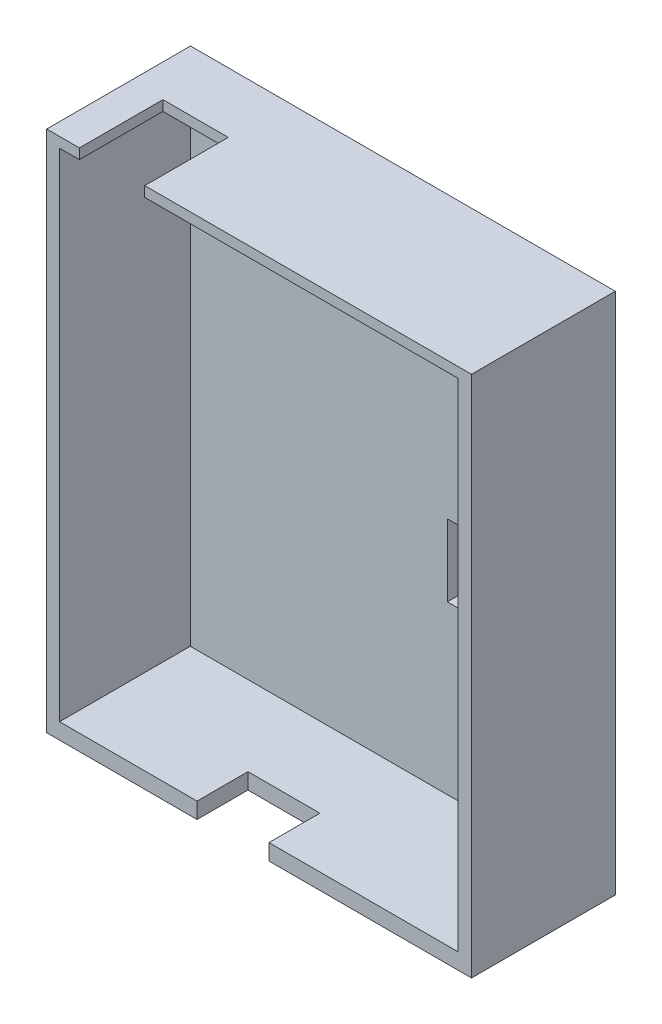
from build123d import *

# Parameters (mm, degrees)
SCHIZZO1_W                   = 65
SCHIZZO1_H                   = 80
ESTRUSIONE_ESTRUSIONE1_DEPTH = 22
SCHIZZO2_W                   = 61
SCHIZZO2_H                   = 76
TAGLIO_ESTRUSIONE1_DEPTH     = 20
SCHIZZO4_W                   = 11
SCHIZZO4_H                   = 8.5
TAGLIO_ESTRUSIONE2_DEPTH     = 3
SCHIZZO5_W                   = 23
SCHIZZO5_H                   = 11
TAGLIO_ESTRUSIONE3_DEPTH     = 3
SCHIZZO6_W                   = 10
SCHIZZO6_H                   = 14
TAGLIO_ESTRUSIONE4_DEPTH     = 3


with BuildPart() as part:
    # Schizzo1 → Estrusione-Estrusione1 (new body)
    with BuildSketch(Plane.XY):
        with Locations((8.270457538, 8.882113821)):
            Rectangle(SCHIZZO1_W, SCHIZZO1_H)
    extrude(amount=ESTRUSIONE_ESTRUSIONE1_DEPTH)

    # Schizzo2 → Taglio-Estrusione1 (cut)
    with BuildSketch(Plane.XY.offset(22)):
        with Locations((8.235197237, 9.324988178)):
            Rectangle(SCHIZZO2_W, SCHIZZO2_H)
    extrude(amount=-TAGLIO_ESTRUSIONE1_DEPTH, mode=Mode.SUBTRACT)

    # Schizzo4 → Taglio-Estrusione2 (cut)
    with BuildSketch(Plane.XZ.offset(31.117886179)):
        with Locations((4.269357769, 18.454892341)):
            Rectangle(SCHIZZO4_W, SCHIZZO4_H)
    extrude(amount=-TAGLIO_ESTRUSIONE2_DEPTH, mode=Mode.SUBTRACT)

    # Schizzo5 → Taglio-Estrusione3 (cut)
    with BuildSketch(Plane(origin=(0, 0, 0), x_dir=(-1, 0, 0), z_dir=(0, 0, -1))):
        with Locations((-28.573968875, 2.379418808)):
            Rectangle(SCHIZZO5_W, SCHIZZO5_H)
    extrude(amount=-TAGLIO_ESTRUSIONE3_DEPTH, mode=Mode.SUBTRACT)

    # Schizzo6 → Taglio-Estrusione4 (cut)
    with BuildSketch(Plane(origin=(0, 48.882113821, 0), x_dir=(1, 0, 0), z_dir=(0, 1, 0))):
        with Locations((-14.227965798, -16.217758031)):
            Rectangle(SCHIZZO6_W, SCHIZZO6_H)
    extrude(amount=-TAGLIO_ESTRUSIONE4_DEPTH, mode=Mode.SUBTRACT)


solid = part.part
